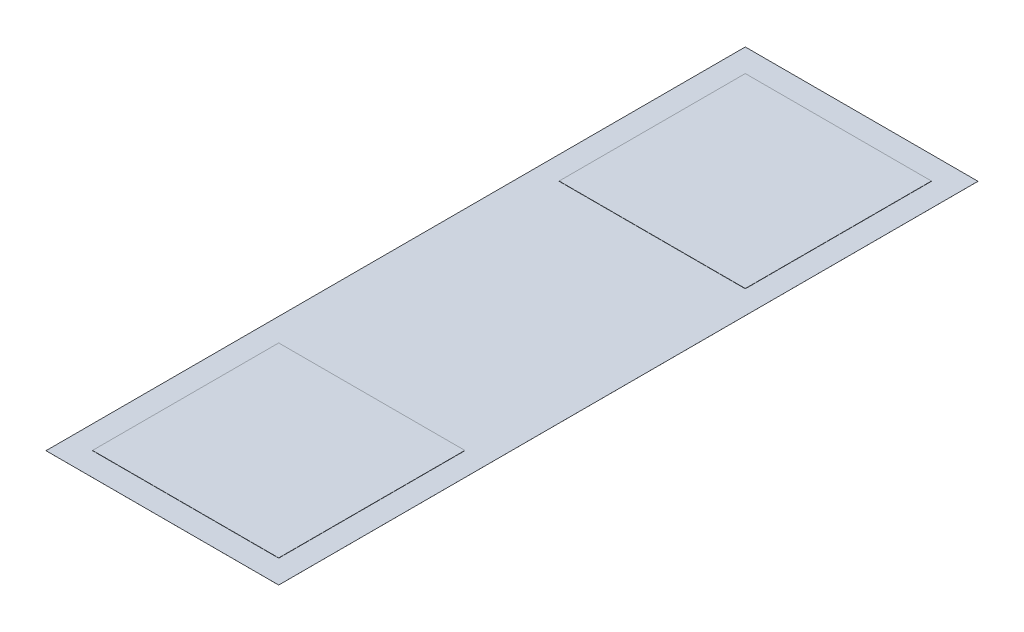
from build123d import *

# Parameters (mm, degrees)
SKETCH1_W           = 100
SKETCH1_H           = 300.51
BOSS_EXTRUDE1_DEPTH = 0.01
SKETCH2_W           = 80
SKETCH2_H           = 80
BOSS_EXTRUDE2_DEPTH = 0.1


with BuildPart() as part:
    # Sketch1 → Boss-Extrude1 (new body)
    with BuildSketch(Plane(origin=(0, 0, 0), x_dir=(1, 0, 0), z_dir=(0, 1, 0))):
        Rectangle(SKETCH1_W, SKETCH1_H)
    extrude(amount=BOSS_EXTRUDE1_DEPTH)

    # Sketch2 → Boss-Extrude2 (add)
    with BuildSketch(Plane(origin=(0, 0.01, 0), x_dir=(1, 0, 0), z_dir=(0, 1, 0))):
        with Locations((0, -100.255)):
            Rectangle(SKETCH2_W, SKETCH2_H)
        with Locations((0, 100.255)):
            Rectangle(SKETCH2_W, SKETCH2_H)
    extrude(amount=BOSS_EXTRUDE2_DEPTH)


solid = part.part
